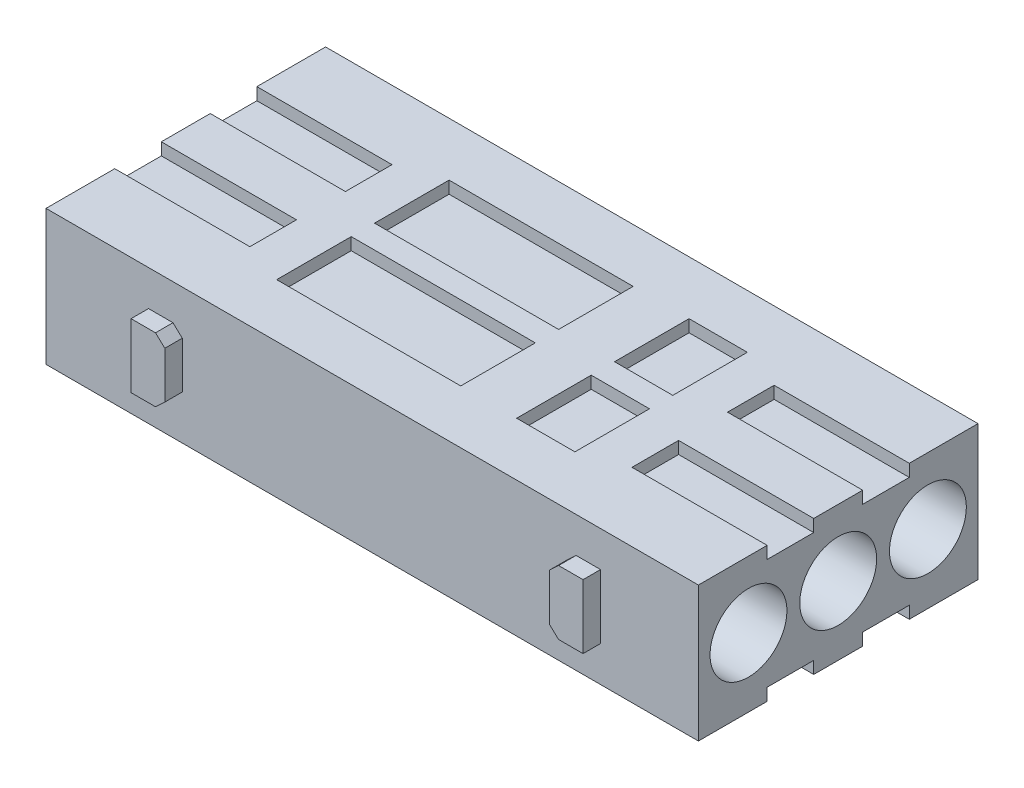
from build123d import *

# Parameters (mm, degrees)
SKETCH1_W           = 71.12
SKETCH1_H           = 30.48
BOSS_EXTRUDE1_DEPTH = 14.732
SKETCH2_R           = 4.191
CUT_EXTRUDE1_DEPTH  = 12.7
CUT_EXTRUDE2_START  = -25.4
SKETCH3_R           = 4.191
CUT_EXTRUDE2_DEPTH  = 25.4
SKETCH4_W           = 14.732
SKETCH4_H           = 5.08
SKETCH4_W_2         = 6.35
SKETCH4_H_2         = 8.128
SKETCH4_W_3         = 20.066
CUT_EXTRUDE3_DEPTH  = 1.3335
BOSS_EXTRUDE2_DEPTH = 1.905
BOSS_EXTRUDE3_DEPTH = 1.905
SKETCH7_W           = 14.732
SKETCH7_H           = 5.08
SKETCH7_W_2         = 20.066
SKETCH7_H_2         = 8.128
SKETCH7_W_3         = 6.35
CUT_EXTRUDE4_DEPTH  = 1.3335


with BuildPart() as part:
    # Sketch1 → Boss-Extrude1 (new body)
    with BuildSketch(Plane(origin=(0, 0, 0), x_dir=(1, 0, 0), z_dir=(0, 1, 0))):
        with Locations((35.56, 15.24)):
            Rectangle(SKETCH1_W, SKETCH1_H)
    extrude(amount=BOSS_EXTRUDE1_DEPTH)

    # Sketch2 → Cut-Extrude1 (cut)
    with BuildSketch(Plane(origin=(71.12, 0, 0), x_dir=(0, 0, -1), z_dir=(1, 0, 0))):
        with Locations((15.24, 7.493)):
            Circle(SKETCH2_R)
        with Locations((25.019, 7.493)):
            Circle(SKETCH2_R)
        with Locations((5.461, 7.493)):
            Circle(SKETCH2_R)
    extrude(amount=-CUT_EXTRUDE1_DEPTH, mode=Mode.SUBTRACT)

    # Sketch3 → Cut-Extrude2 (cut)
    with BuildSketch(Plane.ZY.offset(CUT_EXTRUDE2_START)):
        with Locations(Location((-15.24, 7.493, 0), (0, 0, 180))):
            Circle(SKETCH3_R)
        with Locations(Location((-5.461, 7.493, 0), (0, 0, 180))):
            Circle(SKETCH3_R)
        with Locations(Location((-25.019, 7.493, 0), (0, 0, 180))):
            Circle(SKETCH3_R)
    extrude(amount=CUT_EXTRUDE2_DEPTH, mode=Mode.SUBTRACT)

    # Sketch4 → Cut-Extrude3 (cut)
    with BuildSketch(Plane(origin=(0, 14.732, 0), x_dir=(1, 0, 0), z_dir=(0, 1, 0))):
        with Locations((63.754, 20.447)):
            Rectangle(SKETCH4_W, SKETCH4_H)
        with Locations((63.754, 10.033)):
            Rectangle(SKETCH4_W, SKETCH4_H)
        with Locations((48.641, 20.574)):
            Rectangle(SKETCH4_W_2, SKETCH4_H_2)
        with Locations((48.641, 9.906)):
            Rectangle(SKETCH4_W_2, SKETCH4_H_2)
        with Locations((29.337, 20.574)):
            Rectangle(SKETCH4_W_3, SKETCH4_H_2)
        with Locations((29.337, 9.906)):
            Rectangle(SKETCH4_W_3, SKETCH4_H_2)
        with Locations((7.366, 20.447)):
            Rectangle(SKETCH4_W, SKETCH4_H)
        with Locations((7.366, 10.033)):
            Rectangle(SKETCH4_W, SKETCH4_H)
    extrude(amount=-CUT_EXTRUDE3_DEPTH, mode=Mode.SUBTRACT)

    # Sketch5 → Boss-Extrude2 (add)
    with BuildSketch(Plane.XY):
        Polygon((60.452, 3.8735), (60.452, 10.8585), (57.785, 10.8585), (56.769, 9.906), (56.769, 4.826), (57.785, 3.8735), align=None)
        Polygon((13.843, 3.8735), (11.176, 3.8735), (11.176, 10.8585), (13.843, 10.8585), (14.859, 9.906), (14.859, 4.826), align=None)
    extrude(amount=BOSS_EXTRUDE2_DEPTH)

    # Sketch6 → Boss-Extrude3 (add)
    with BuildSketch(Plane(origin=(0, 0, -30.48), x_dir=(-1, 0, 0), z_dir=(0, 0, -1))):
        Polygon((-60.452, 11.938), (-60.452, 2.794), (-57.785, 2.794), (-56.769, 3.937), (-56.769, 10.795), (-57.785, 11.938), align=None)
        Polygon((-13.335, 11.938), (-10.668, 11.938), (-10.668, 2.794), (-13.335, 2.794), (-14.351, 3.937), (-14.351, 10.795), align=None)
    extrude(amount=BOSS_EXTRUDE3_DEPTH)

    # Sketch7 → Cut-Extrude4 (cut)
    with BuildSketch(Plane.XZ):
        with Locations((7.366, -20.447)):
            Rectangle(SKETCH7_W, SKETCH7_H)
        with Locations((7.366, -10.033)):
            Rectangle(SKETCH7_W, SKETCH7_H)
        with Locations((29.337, -20.574)):
            Rectangle(SKETCH7_W_2, SKETCH7_H_2)
        with Locations((29.337, -9.906)):
            Rectangle(SKETCH7_W_2, SKETCH7_H_2)
        with Locations((48.641, -20.574)):
            Rectangle(SKETCH7_W_3, SKETCH7_H_2)
        with Locations((48.641, -9.906)):
            Rectangle(SKETCH7_W_3, SKETCH7_H_2)
        with Locations((63.754, -20.447)):
            Rectangle(SKETCH7_W, SKETCH7_H)
        with Locations((63.754, -10.033)):
            Rectangle(SKETCH7_W, SKETCH7_H)
    extrude(amount=-CUT_EXTRUDE4_DEPTH, mode=Mode.SUBTRACT)


solid = part.part
